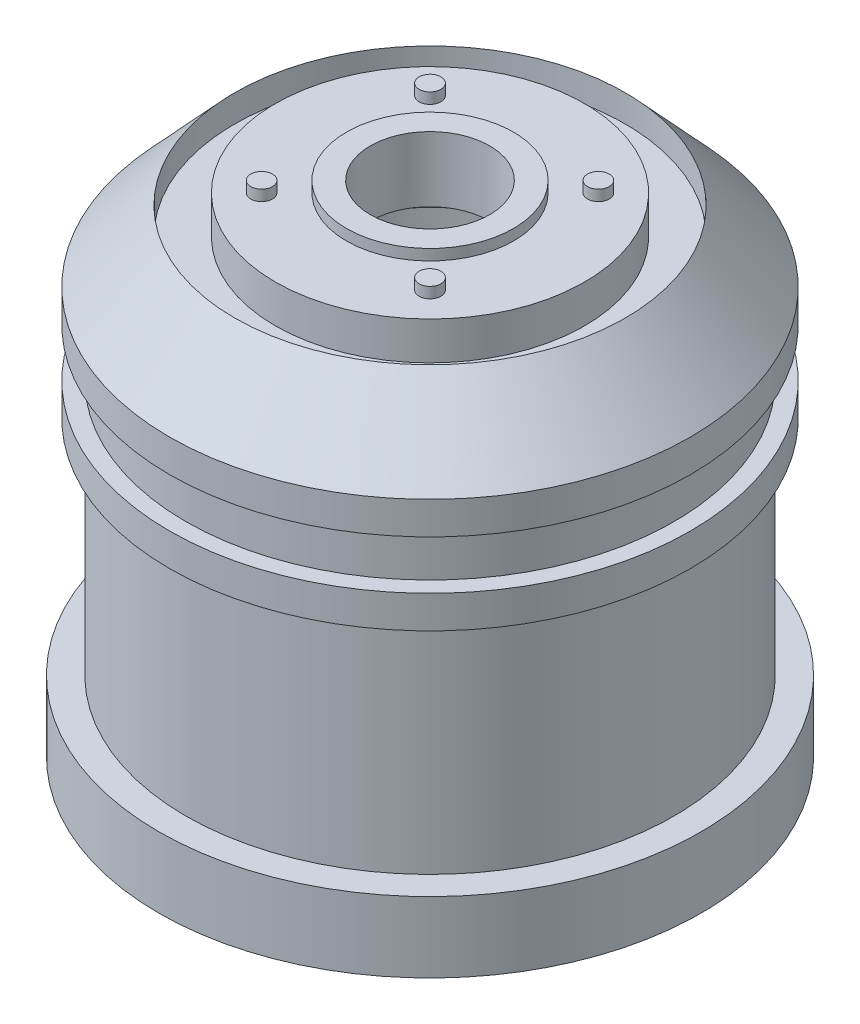
from build123d import *

# Parameters (mm, degrees)
SKETCH1_R               = 12.7
BOTTOM_LIP_DEPTH        = 3.302
SKETCH2_R               = 11.43
BOSS_EXTRUDE3_DEPTH     = 10.414
SKETCH3_R               = 12.192
BOSS_EXTRUDE4_DEPTH     = 1.524
SKETCH4_R               = 11.43
BOSS_EXTRUDE5_DEPTH     = 2.286
SKETCH5_R               = 12.192
BOSS_EXTRUDE7_DEPTH     = 1.524
SKETCH6_R               = 12.192
BOSS_EXTRUDE8_DEPTH     = 3.302
BOSS_EXTRUDE8_TAPER     = 42.72727272
SKETCH12_R              = 7.239
BOSS_EXTRUDE9_DEPTH     = 0.508
SKETCH13_R              = 9.14209071
CUT_EXTRUDE2_DEPTH      = 1.27
SKETCH14_R              = 7.239
BOSS_EXTRUDE10_DEPTH    = 1.778
CUT_EXTRUDE3_DEPTH      = 30.071628781
CUT_EXTRUDE3_DEPTH_BACK = 30.071628781
SKETCH15_R              = 2.794
SKETCH16_R              = 9.525
CUT_EXTRUDE4_DEPTH      = 20.32
SKETCH17_R              = 7.239
SKETCH17_R_2            = 6.35
BOSS_EXTRUDE11_DEPTH    = 2.54
SKETCH18_R              = 3.911149558
BOSS_EXTRUDE15_DEPTH    = 0.508
SKETCH19_R              = 2.794
CUT_EXTRUDE5_DEPTH      = 30.472757319
SKETCH20_R              = 0.508
BOSS_EXTRUDE16_DEPTH    = 0.508


with BuildPart() as part:
    # Sketch1 → Bottom_Lip (new body)
    with BuildSketch(Plane(origin=(0, 0, 0), x_dir=(1, 0, 0), z_dir=(0, 1, 0))):
        with Locations(Location((0, 0, 0), (0, 0, 90))):
            Circle(SKETCH1_R)
    extrude(amount=BOTTOM_LIP_DEPTH)

    # Sketch2 → Boss-Extrude3 (add)
    with BuildSketch(Plane(origin=(0, 3.302, 0), x_dir=(1, 0, 0), z_dir=(0, 1, 0))):
        with Locations(Location((0, 0, 0), (0, 0, 270))):
            Circle(SKETCH2_R)
    extrude(amount=BOSS_EXTRUDE3_DEPTH)

    # Sketch3 → Boss-Extrude4 (add)
    with BuildSketch(Plane(origin=(0, 13.716, 0), x_dir=(1, 0, 0), z_dir=(0, 1, 0))):
        with Locations(Location((0, 0, 0), (0, 0, 90))):
            Circle(SKETCH3_R)
    extrude(amount=BOSS_EXTRUDE4_DEPTH)

    # Sketch4 → Boss-Extrude5 (add)
    with BuildSketch(Plane(origin=(0, 15.24, 0), x_dir=(1, 0, 0), z_dir=(0, 1, 0))):
        with Locations(Location((0, 0, 0), (0, 0, 270))):
            Circle(SKETCH4_R)
    extrude(amount=BOSS_EXTRUDE5_DEPTH)

    # Sketch5 → Boss-Extrude7 (add)
    with BuildSketch(Plane(origin=(0, 17.526, 0), x_dir=(1, 0, 0), z_dir=(0, 1, 0))):
        with Locations(Location((0, 0, 0), (0, 0, 90))):
            Circle(SKETCH5_R)
    extrude(amount=BOSS_EXTRUDE7_DEPTH)


with BuildPart() as body_2:
    # Sketch6 → Boss-Extrude8 (new body)
    with BuildSketch(Plane(origin=(0, 19.05, 0), x_dir=(1, 0, 0), z_dir=(0, 1, 0))):
        with Locations(Location((0, 0, 0), (0, 0, 90))):
            Circle(SKETCH6_R)
    extrude(amount=BOSS_EXTRUDE8_DEPTH, taper=BOSS_EXTRUDE8_TAPER)

    # Sketch12 → Boss-Extrude9 (add)
    with BuildSketch(Plane(origin=(0, 22.352, 0), x_dir=(1, 0, 0), z_dir=(0, 1, 0))):
        with Locations(Location((0, 0, 0), (0, 0, 270))):
            Circle(SKETCH12_R)
    extrude(amount=BOSS_EXTRUDE9_DEPTH)

    # Sketch13 → Cut-Extrude2 (cut)
    with BuildSketch(Plane(origin=(0, 22.352, 0), x_dir=(1, 0, 0), z_dir=(0, 1, 0))):
        with Locations(Location((0, 0, 0), (0, 0, 270))):
            Circle(SKETCH13_R)
    extrude(amount=-CUT_EXTRUDE2_DEPTH, mode=Mode.SUBTRACT)


with BuildPart() as body_3:
    # of the pieces the cut leaves, the one that is kept (cut_extrude2_keep)
    add(body_2.part.solids().sort_by_distance((0, 19.05, -12.192))[0])

    # Sketch14 → Boss-Extrude10 (add)
    with BuildSketch(Plane(origin=(0, 21.082, 0), x_dir=(1, 0, 0), z_dir=(0, 1, 0))):
        with Locations(Location((0, 0, 0), (0, 0, 270))):
            Circle(SKETCH14_R)
    extrude(amount=BOSS_EXTRUDE10_DEPTH)

    # Sketch15 → Cut-Extrude3 (cut, two sides: drawn at the far end of the back side and taken through both)
    with BuildSketch(Plane(origin=(0, 22.86, 0), x_dir=(1, 0, 0), z_dir=(0, 1, 0)).offset(-CUT_EXTRUDE3_DEPTH_BACK)):
        with Locations(Location((0, 0, 0), (0, 0, 270))):
            Circle(SKETCH15_R)
    extrude(amount=CUT_EXTRUDE3_DEPTH + CUT_EXTRUDE3_DEPTH_BACK, mode=Mode.SUBTRACT)


with BuildPart() as cut_extrude4_tool:
    # Sketch16 → Cut-Extrude4 (new body)
    with BuildSketch(Plane.XZ):
        with Locations(Location((0, 0, 0), (0, 0, 270))):
            Circle(SKETCH16_R)
    extrude(amount=-CUT_EXTRUDE4_DEPTH)


with BuildPart() as part_1:
    add(part.part)

    # Cut-Extrude4: cut by cut_extrude4_tool
    add(cut_extrude4_tool.part, mode=Mode.SUBTRACT)



with BuildPart() as body_3_1:
    add(body_3.part)

    # Cut-Extrude4: cut by cut_extrude4_tool
    add(cut_extrude4_tool.part, mode=Mode.SUBTRACT)


with BuildPart() as part_2:
    add(part_1.part)

    add(body_3_1.part)  # Boss-Extrude11 merges body 3
    # Sketch17 → Boss-Extrude11 (add)
    with BuildSketch(Plane.XZ.offset(-20.32)):
        with Locations(Location((0, 0, 0), (0, 0, 90))):
            Circle(SKETCH17_R)
        with Locations(Location((0, 0, 0), (0, 0, 270))):
            Circle(SKETCH17_R_2, mode=Mode.SUBTRACT)
    extrude(amount=BOSS_EXTRUDE11_DEPTH)

    # Sketch18 → Boss-Extrude15 (add)
    with BuildSketch(Plane(origin=(0, 22.86, 0), x_dir=(1, 0, 0), z_dir=(0, 1, 0))):
        with Locations(Location((0, 0, 0), (0, 0, 270))):
            Circle(SKETCH18_R)
    extrude(amount=BOSS_EXTRUDE15_DEPTH)

    # Sketch19 → Cut-Extrude5 (cut, through all)
    with BuildSketch(Plane(origin=(0, 23.368, 0), x_dir=(1, 0, 0), z_dir=(0, 1, 0))):
        with Locations(Location((0, 0, 0), (0, 0, 270))):
            Circle(SKETCH19_R)
    extrude(amount=-CUT_EXTRUDE5_DEPTH, mode=Mode.SUBTRACT)

    # Sketch20 → Boss-Extrude16 (add)
    with BuildSketch(Plane(origin=(0, 22.86, 0), x_dir=(1, 0, 0), z_dir=(0, 1, 0))):
        with Locations(Location((3.942013927, -3.942013927, 0), (0, 0, 270))):
            Circle(SKETCH20_R)
        with Locations(Location((-3.942013927, -3.942013927, 0), (0, 0, 270))):
            Circle(SKETCH20_R)
        with Locations(Location((-3.942013927, 3.942013927, 0), (0, 0, 270))):
            Circle(SKETCH20_R)
        with Locations(Location((3.942013927, 3.942013927, 0), (0, 0, 270))):
            Circle(SKETCH20_R)
    extrude(amount=BOSS_EXTRUDE16_DEPTH)


solid = part_2.part
